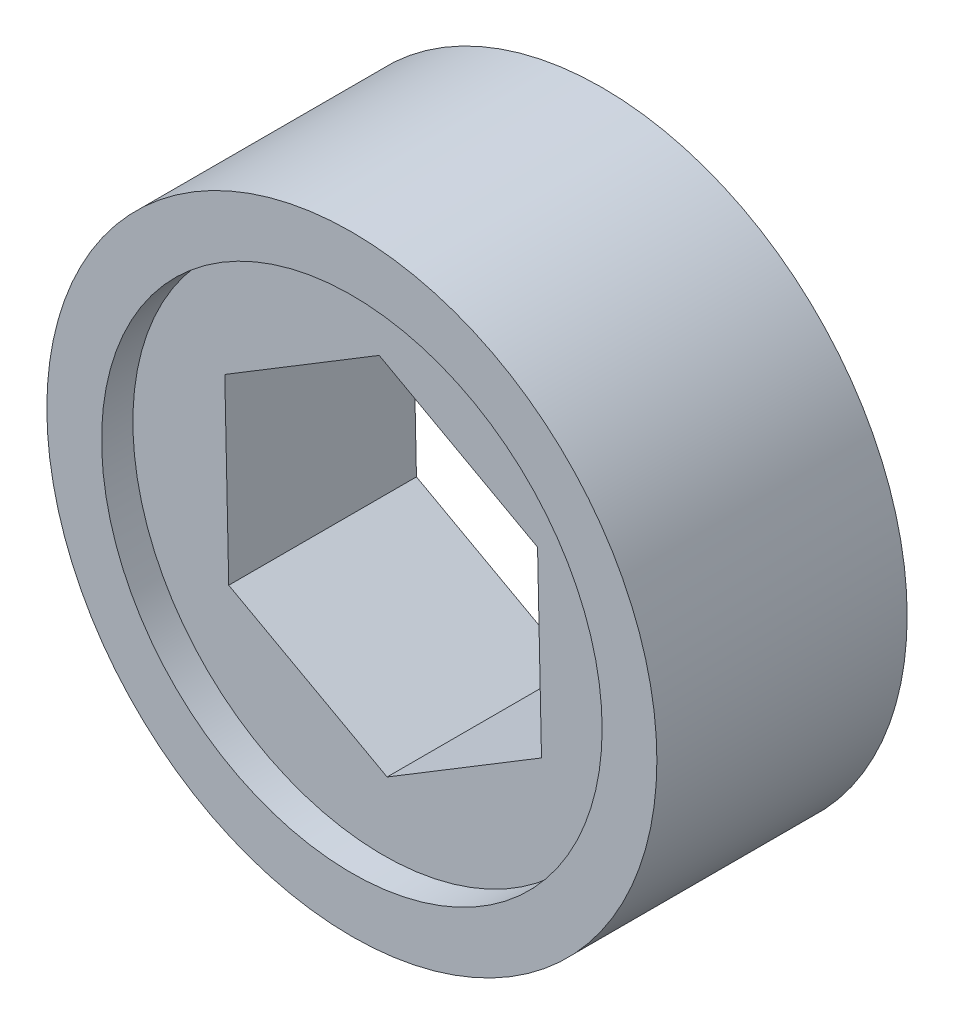
from build123d import *

# Parameters (mm, degrees)
SKETCH1_R               = 12.3825
BOSS_EXTRUDE1_DEPTH     = 10.16
ESQUISSE1_R             = 10.16
ENL_V_MAT_EXTRU_1_DEPTH = 1.27
ENL_V_START             = -1.27
ESQUISSE2_R             = 10.16
ENL_V_MAT_EXTRU_2_DEPTH = 1.27


with BuildPart() as part:
    # Sketch1 → Boss-Extrude1 (new body)
    with BuildSketch(Plane.XY):
        Circle(SKETCH1_R)
        Polygon((0.160352547, -7.330594819), (6.428657611, -3.52642803), (6.268305064, 3.804166789), (-0.160352547, 7.330594819), (-6.428657611, 3.52642803), (-6.268305064, -3.804166789), align=None, mode=Mode.SUBTRACT)
    extrude(amount=BOSS_EXTRUDE1_DEPTH)

    # Esquisse1 → Enlèv. mat.-Extru.1 (cut)
    with BuildSketch(Plane.XY.offset(10.16)):
        Circle(ESQUISSE1_R)
    extrude(amount=-ENL_V_MAT_EXTRU_1_DEPTH, mode=Mode.SUBTRACT)

    # Esquisse2 → Enlèv. mat.-Extru.2 (cut)
    with BuildSketch(Plane(origin=(0, 0, 0), x_dir=(-1, 0, 0), z_dir=(0, 0, -1)).offset(ENL_V_START)):
        with Locations(Location((0, 0, 0), (0, 0, 180))):
            Circle(ESQUISSE2_R)
    extrude(amount=ENL_V_MAT_EXTRU_2_DEPTH, mode=Mode.SUBTRACT)


solid = part.part
